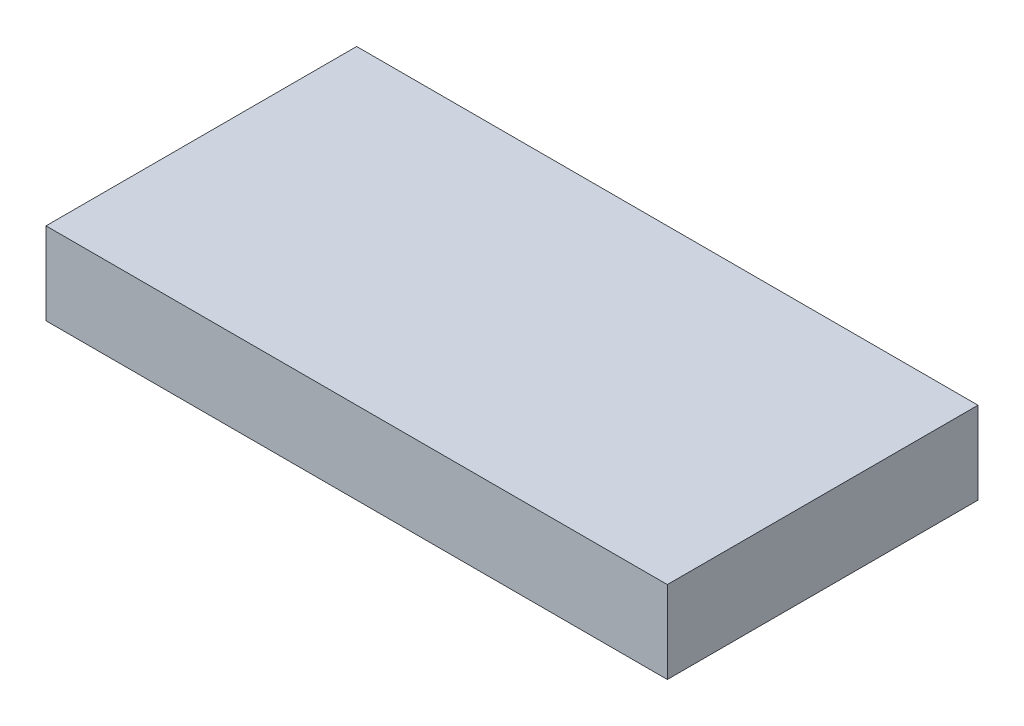
from build123d import *

# Parameters (mm, degrees)
SKETCH1_W           = 431.8
SKETCH1_H           = 215.9
BOSS_EXTRUDE1_DEPTH = 57.15
SKETCH2_R           = 25.4
BOSS_EXTRUDE2_DEPTH = 3.175


with BuildPart() as part:
    # Sketch1 → Boss-Extrude1 (new body)
    with BuildSketch(Plane(origin=(0, 0, 0), x_dir=(1, 0, 0), z_dir=(0, 1, 0))):
        Rectangle(SKETCH1_W, SKETCH1_H)
    extrude(amount=BOSS_EXTRUDE1_DEPTH)

    # Sketch2 → Boss-Extrude2 (add)
    with BuildSketch(Plane.XZ):
        with Locations(Location((-177.8, 69.85, 0), (0, 0, 270))):
            Circle(SKETCH2_R)
        with Locations(Location((-177.8, -69.85, 0), (0, 0, 270))):
            Circle(SKETCH2_R)
        with Locations(Location((177.8, -69.85, 0), (0, 0, 270))):
            Circle(SKETCH2_R)
        with Locations(Location((177.8, 69.85, 0), (0, 0, 270))):
            Circle(SKETCH2_R)
    extrude(amount=BOSS_EXTRUDE2_DEPTH)


solid = part.part
